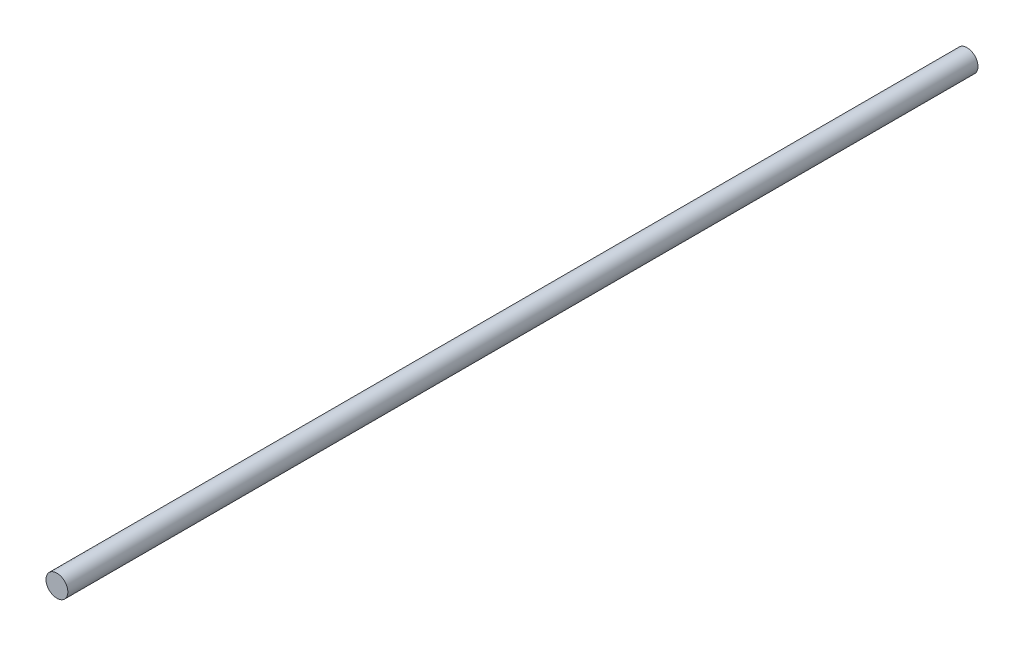
from build123d import *

# Parameters (mm, degrees)
SKETCH1_R           = 0.9
BOSS_EXTRUDE1_DEPTH = 75


with BuildPart() as part:
    # Sketch1 → Boss-Extrude1 (new body)
    with BuildSketch(Plane.XY):
        Circle(SKETCH1_R)
    extrude(amount=BOSS_EXTRUDE1_DEPTH)


solid = part.part
